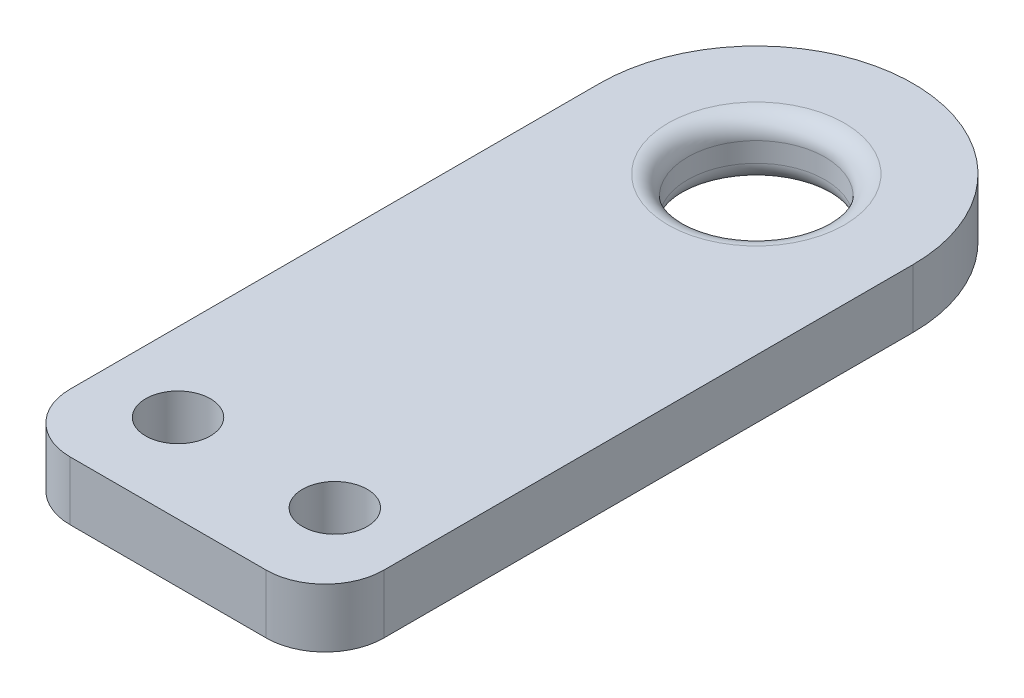
from build123d import *

# Parameters (mm, degrees)
BOSS_EXTRUDE1_DEPTH      = 1.5
BOSS_EXTRUDE1_DEPTH_BACK = 1.5
SKETCH2_R                = 8
SKETCH3_W                = 16
SKETCH3_H                = 30
BOSS_EXTRUDE2_DEPTH      = 1.5
CUT_EXTRUDE1_REACH       = 33.193
SKETCH4_R                = 1.65
CUT_EXTRUDE2_REACH       = 33.193
SKETCH5_R                = 3.5
FILLET1_R                = 1
FILLET2_R                = 3


with BuildPart() as part:
    # Sketch2 → Boss-Extrude1 (new, two sides: drawn at the far end of the back side and taken through both)
    with BuildSketch(Plane(origin=(0, 0, 0), x_dir=(1, 0, 0), z_dir=(0, 1, 0)).offset(-BOSS_EXTRUDE1_DEPTH_BACK)):
        Circle(SKETCH2_R)
    extrude(amount=BOSS_EXTRUDE1_DEPTH + BOSS_EXTRUDE1_DEPTH_BACK)

    # Sketch3 → Boss-Extrude2 (add, symmetric)
    with BuildSketch(Plane(origin=(0, 0, 0), x_dir=(1, 0, 0), z_dir=(0, 1, 0))):
        with Locations((0, -15)):
            Rectangle(SKETCH3_W, SKETCH3_H)
    extrude(amount=BOSS_EXTRUDE2_DEPTH, both=True)

    # Sketch4 → Cut-Extrude1 (cut, up to next)
    with BuildSketch(Plane(origin=(0, 1.5, 0), x_dir=(1, 0, 0), z_dir=(0, 1, 0)), mode=Mode.PRIVATE) as cut_extrude1_sk1:
        with Locations((4, -25.5)):
            Circle(SKETCH4_R)
    cut_extrude1_tool1 = extrude(cut_extrude1_sk1.sketch, amount=-CUT_EXTRUDE1_REACH, mode=Mode.PRIVATE) & part.part
    # Sketch4 → Cut-Extrude1 (cut, up to next)
    with BuildSketch(Plane(origin=(0, 1.5, 0), x_dir=(1, 0, 0), z_dir=(0, 1, 0)), mode=Mode.PRIVATE) as cut_extrude1_sk2:
        with Locations((-4, -25.5)):
            Circle(SKETCH4_R)
    cut_extrude1_tool2 = extrude(cut_extrude1_sk2.sketch, amount=-CUT_EXTRUDE1_REACH, mode=Mode.PRIVATE) & part.part
    add(cut_extrude1_tool1.solids().sort_by_distance((4, 1.5, 25.5))[0], mode=Mode.SUBTRACT)
    add(cut_extrude1_tool2.solids().sort_by_distance((-4, 1.5, 25.5))[0], mode=Mode.SUBTRACT)

    # Sketch5 → Cut-Extrude2 (cut, up to next)
    with BuildSketch(Plane.XZ.offset(1.5), mode=Mode.PRIVATE) as cut_extrude2_sk1:
        Circle(SKETCH5_R)
    cut_extrude2_tool1 = extrude(cut_extrude2_sk1.sketch, amount=-CUT_EXTRUDE2_REACH, mode=Mode.PRIVATE) & part.part
    add(cut_extrude2_tool1.solids().sort_by_distance((0, -1.5, 0))[0], mode=Mode.SUBTRACT)

    # Fillet1
    fillet1_edges = [part.edges().sort_by_distance(p)[0] for p in [
        (-3.5, 1.5, 0),
        (-3.5, -1.5, 0),
    ]]
    fillet(fillet1_edges, radius=FILLET1_R)

    # Fillet2
    fillet2_edges = [part.edges().sort_by_distance(p)[0] for p in [
        (-8, 0, 30),
        (8, 0, 30),
    ]]
    fillet(fillet2_edges, radius=FILLET2_R)


solid = part.part
